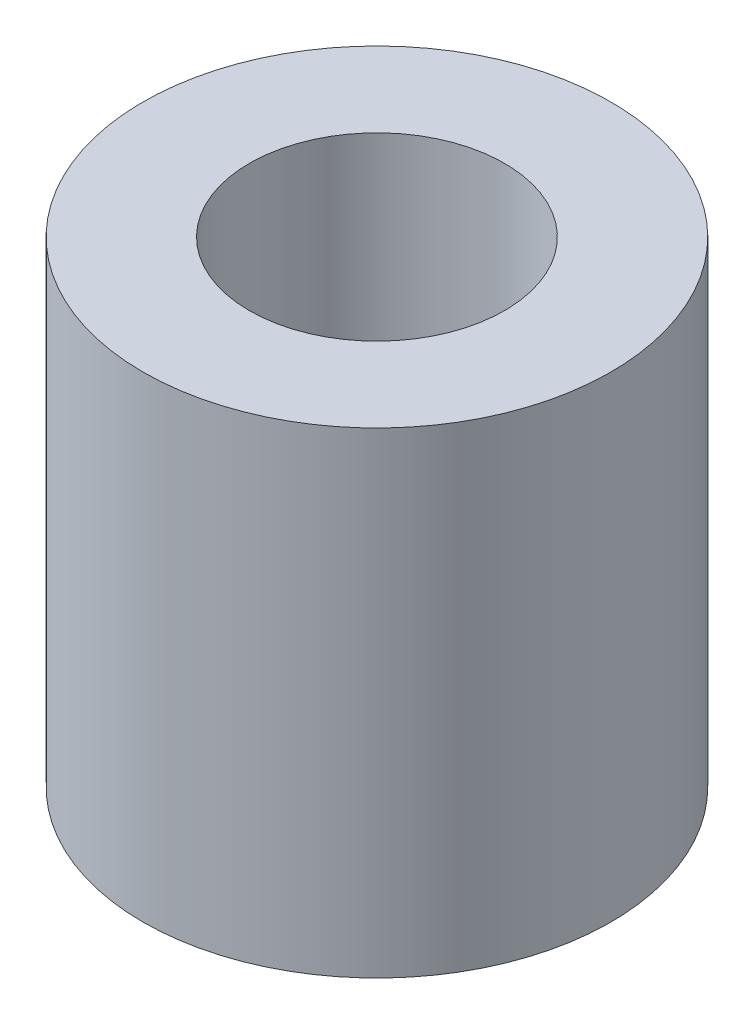
from build123d import *

# Parameters (mm, degrees)
SKETCH1_R           = 2.75
SKETCH1_R_2         = 1.5
BOSS_EXTRUDE1_DEPTH = 5.6


with BuildPart() as part:
    # Sketch1 → Boss-Extrude1 (new body)
    with BuildSketch(Plane(origin=(0, 0, 0), x_dir=(1, 0, 0), z_dir=(0, 1, 0))):
        with Locations(Location((0, 0, 0), (0, 0, 270))):
            Circle(SKETCH1_R)
        with Locations(Location((0, 0, 0), (0, 0, 270))):
            Circle(SKETCH1_R_2, mode=Mode.SUBTRACT)
    extrude(amount=BOSS_EXTRUDE1_DEPTH)


solid = part.part
